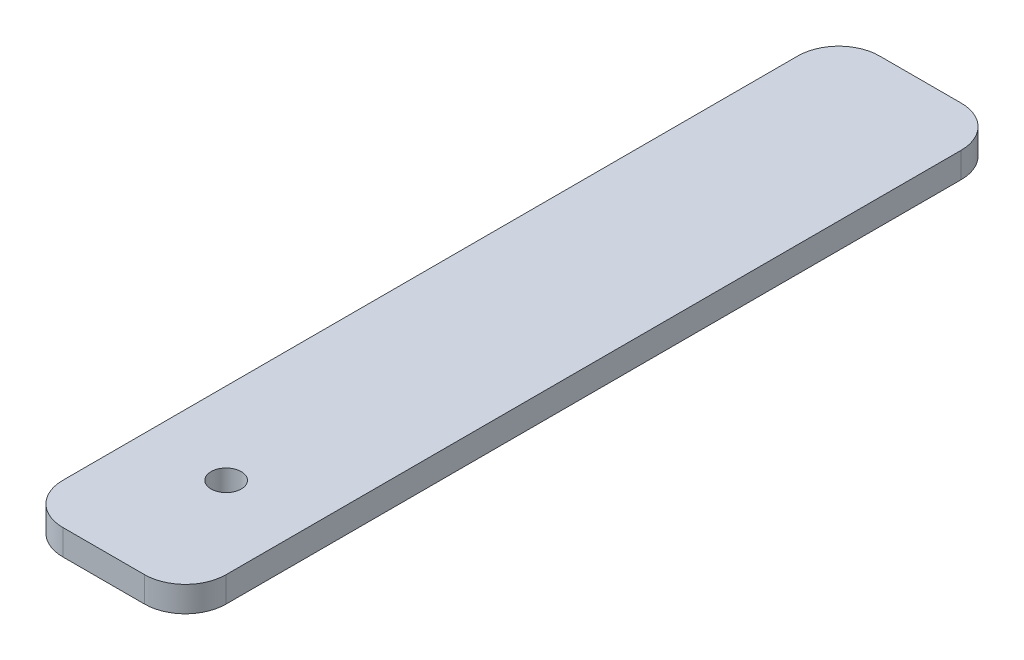
from build123d import *

# Parameters (mm, degrees)
SKETCH1_W           = 10.16
SKETCH1_H           = 50.8
SKETCH1_R           = 0.9398
BOSS_EXTRUDE1_DEPTH = 1.5875
FILLET1_R           = 2.54


with BuildPart() as part:
    # Sketch1 → Boss-Extrude1 (new body)
    with BuildSketch(Plane(origin=(0, 0, 0), x_dir=(1, 0, 0), z_dir=(0, 1, 0))):
        with Locations((5.08, 25.4)):
            Rectangle(SKETCH1_W, SKETCH1_H)
        with Locations(Location((5.08, 7.62, 0), (0, 0, 270))):
            Circle(SKETCH1_R, mode=Mode.SUBTRACT)
    extrude(amount=BOSS_EXTRUDE1_DEPTH)

    # Fillet1
    fillet1_edges = [part.edges().sort_by_distance(p)[0] for p in [
        (0, 0.79375, -50.8),
        (10.16, 0.79375, -50.8),
        (10.16, 0.79375, 0),
        (0, 0.79375, 0),
    ]]
    fillet(fillet1_edges, radius=FILLET1_R)


solid = part.part
